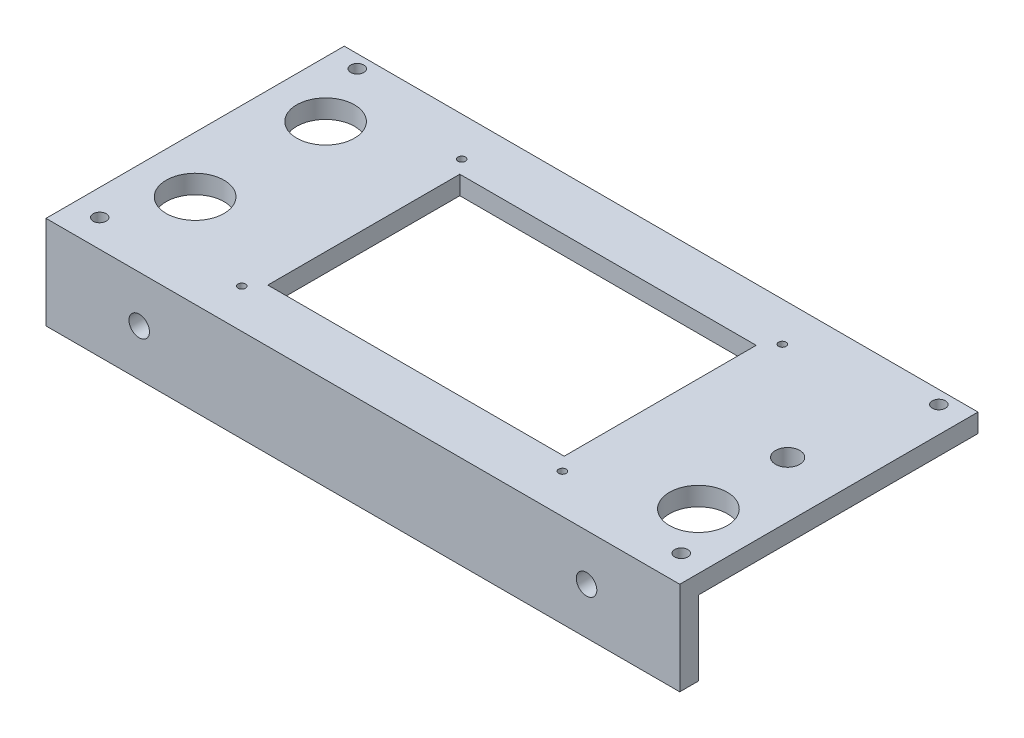
from build123d import *

# Parameters (mm, degrees)
SKETCH_1_W          = 170
SKETCH_1_H          = 80
EXTRUDE_1_DEPTH     = 5
SKETCH_2_R          = 7.75
SKETCH_2_R_2        = 3.25
SKETCH_2_W          = 79.5
SKETCH_2_H          = 51.5
CUT_EXTRUDE_1_DEPTH = 151.961816214
SKETCH_5_W          = 170
SKETCH_5_H          = 25
EXTRUDE_3_DEPTH     = 5
SKETCH_7_R          = 2.75
CUT_EXTRUDE_4_DEPTH = 165.330739172
SKETCH_9_R          = 1
CUT_EXTRUDE_5_DEPTH = 153.19878434
SKETCH_10_R         = 1.75
CUT_EXTRUDE_6_DEPTH = 153.936163005


with BuildPart() as part:
    # 草图1 → 凸台-拉伸1 (new body)
    with BuildSketch(Plane(origin=(0, 0, 0), x_dir=(1, 0, 0), z_dir=(0, 1, 0))):
        with Locations((57.142857143, -10.595238095)):
            Rectangle(SKETCH_1_W, SKETCH_1_H)
    extrude(amount=EXTRUDE_1_DEPTH)

    # 草图2 → 切除-拉伸1 (cut, through all)
    with BuildSketch(Plane(origin=(0, 5, 0), x_dir=(1, 0, 0), z_dir=(0, 1, 0))):
        with Locations(Location((-12.857142857, 9.404761905, 0), (0, 0, 270))):
            Circle(SKETCH_2_R)
        with Locations(Location((-12.857142857, -25.595238095, 0), (0, 0, 270))):
            Circle(SKETCH_2_R)
        with Locations(Location((127.142857143, -6.659623692, 0), (0, 0, 270))):
            Circle(SKETCH_2_R_2)
        with Locations(Location((127.142857143, -30.595238095, 0), (0, 0, 270))):
            Circle(SKETCH_2_R)
        with Locations((57.142857143, -10.595238095)):
            Rectangle(SKETCH_2_W, SKETCH_2_H)
    extrude(amount=-CUT_EXTRUDE_1_DEPTH, mode=Mode.SUBTRACT)

    # 草图5 → 凸台-拉伸3 (add)
    with BuildSketch(Plane(origin=(0, 0, 50.595238095), x_dir=(-1, 0, 0), z_dir=(0, 0, -1))):
        with Locations((-57.142857143, -7.5)):
            Rectangle(SKETCH_5_W, SKETCH_5_H)
    extrude(amount=EXTRUDE_3_DEPTH)

    # 草图7 → 切除-拉伸4 (cut, through all)
    with BuildSketch(Plane.XY.offset(50.595238095)):
        with Locations((-2.857142857, -7.5)):
            Circle(SKETCH_7_R)
        with Locations((117.142857143, -7.5)):
            Circle(SKETCH_7_R)
    extrude(amount=-CUT_EXTRUDE_4_DEPTH, mode=Mode.SUBTRACT)

    # 草图9 → 切除-拉伸5 (cut, through all)
    with BuildSketch(Plane.XZ):
        with Locations(Location((14.142857143, -18.904761905, 0), (0, 0, 270))):
            Circle(SKETCH_9_R)
        with Locations(Location((100.142857143, -18.904761905, 0), (0, 0, 270))):
            Circle(SKETCH_9_R)
        with Locations(Location((100.142857143, 40.095238095, 0), (0, 0, 270))):
            Circle(SKETCH_9_R)
        with Locations(Location((14.142857143, 40.095238095, 0), (0, 0, 270))):
            Circle(SKETCH_9_R)
    extrude(amount=-CUT_EXTRUDE_5_DEPTH, mode=Mode.SUBTRACT)

    # 草图10 → 切除-拉伸6 (cut, through all)
    with BuildSketch(Plane(origin=(0, 5, 0), x_dir=(1, 0, 0), z_dir=(0, 1, 0))):
        with Locations(Location((-20.857142857, 25.904761905, 0), (0, 0, 270))):
            Circle(SKETCH_10_R)
        with Locations(Location((-20.857142857, -43.191421848, 0), (0, 0, 270))):
            Circle(SKETCH_10_R)
        with Locations(Location((135.142857143, -43.191421848, 0), (0, 0, 270))):
            Circle(SKETCH_10_R)
        with Locations(Location((135.142857143, 25.904761905, 0), (0, 0, 270))):
            Circle(SKETCH_10_R)
    extrude(amount=-CUT_EXTRUDE_6_DEPTH, mode=Mode.SUBTRACT)


solid = part.part
